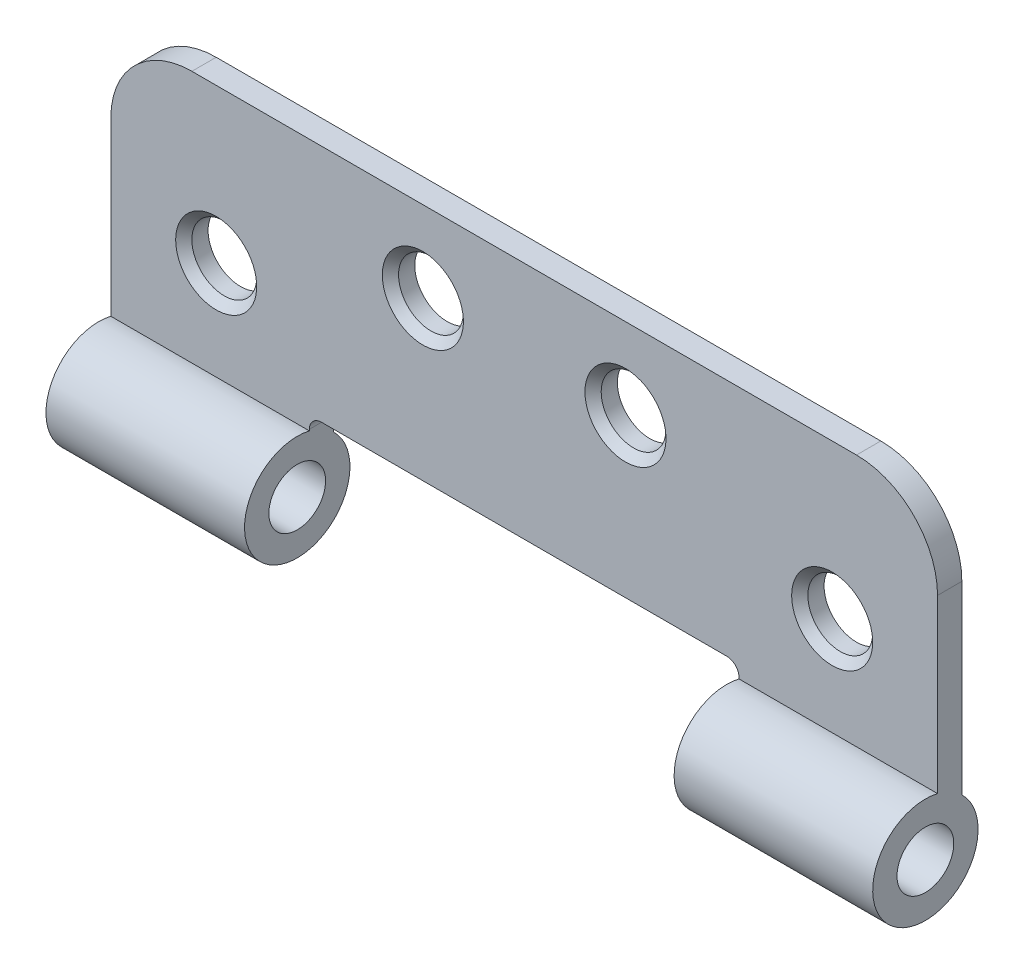
from build123d import *

# Parameters (mm, degrees)
SKETCH1_R               = 4
BOSS_EXTRUDE1_DEPTH     = 3
SKETCH2_R               = 6.5
BOSS_EXTRUDE2_DEPTH     = 102
SKETCH3_R               = 3.5
CUT_EXTRUDE1_DEPTH      = 110.230261375
CUT_EXTRUDE2_DEPTH      = 64.806347647
CUT_EXTRUDE2_DEPTH_BACK = 64.806347647
SKETCH4_W               = 53
SKETCH4_H               = 14.5
FILLET1_R               = 1.5
CHAMFER1_SIZE           = 1


with BuildPart() as part:
    # Sketch1 → Boss-Extrude1 (new body)
    with BuildSketch(Plane.XY):
        with BuildLine():
            Line((-51, 0), (51, 0))
            Line((51, 0), (51, 27.5))
            ThreePointArc((51, 27.5), (48.071067812, 34.571067812), (41, 37.5))
            Line((41, 37.5), (-41, 37.5))
            ThreePointArc((-41, 37.5), (-48.071067812, 34.571067812), (-51, 27.5))
            Line((-51, 27.5), (-51, 0))
        make_face()
        with Locations((-38, 18.5)):
            Circle(SKETCH1_R, mode=Mode.SUBTRACT)
        with Locations((38, 18.5)):
            Circle(SKETCH1_R, mode=Mode.SUBTRACT)
        with Locations((-12.5, 27.5)):
            Circle(SKETCH1_R, mode=Mode.SUBTRACT)
        with Locations((12.5, 27.5)):
            Circle(SKETCH1_R, mode=Mode.SUBTRACT)
    extrude(amount=BOSS_EXTRUDE1_DEPTH)

    # Sketch2 → Boss-Extrude2 (add)
    with BuildSketch(Plane.ZY.offset(51)):
        with Locations((4.5, 0)):
            Circle(SKETCH2_R)
    extrude(amount=-BOSS_EXTRUDE2_DEPTH)

    # Sketch3 → Cut-Extrude1 (cut, through all)
    with BuildSketch(Plane.ZY.offset(51)):
        with Locations((4.5, 0)):
            Circle(SKETCH3_R)
    extrude(amount=-CUT_EXTRUDE1_DEPTH, mode=Mode.SUBTRACT)

    # Sketch4 → Cut-Extrude2 (cut, two sides: drawn at the far end of the back side and taken through both)
    with BuildSketch(Plane.XY.offset(3).offset(-CUT_EXTRUDE2_DEPTH_BACK)):
        with Locations((0, 0.75)):
            Rectangle(SKETCH4_W, SKETCH4_H)
    extrude(amount=CUT_EXTRUDE2_DEPTH + CUT_EXTRUDE2_DEPTH_BACK, mode=Mode.SUBTRACT)

    # Fillet1
    fillet1_edges = [part.edges().sort_by_distance(p)[0] for p in [
        (-26.5, 8, 1.5),
        (26.5, 8, 1.5),
    ]]
    fillet(fillet1_edges, radius=FILLET1_R)

    # Chamfer1
    chamfer1_edges = [part.edges().sort_by_distance(p)[0] for p in [
        (-42, 18.5, 3),
        (34, 18.5, 3),
        (-16.5, 27.5, 3),
        (8.5, 27.5, 3),
    ]]
    chamfer(chamfer1_edges, length=CHAMFER1_SIZE)


solid = part.part
